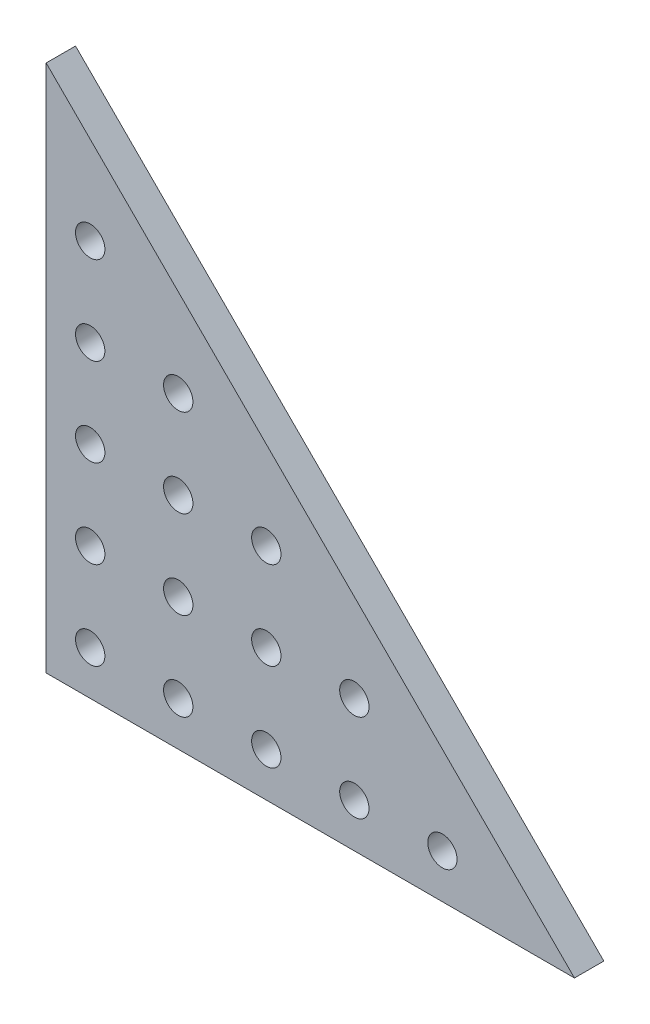
from build123d import *

# Parameters (mm, degrees)
MODEL_R                 = 1.5
SALIENTE_EXTRUIR1_DEPTH = 3


with BuildPart() as part:
    # Model → Saliente-Extruir1 (new body)
    with BuildSketch(Plane.XY):
        Polygon((-105.943383637, 105.556539338), (-105.943383637, 51.556539338), (-51.943383637, 51.556539338), align=None)
        with Locations((-101.443383637, 92.056539338)):
            Circle(MODEL_R, mode=Mode.SUBTRACT)
        with Locations((-101.443383637, 83.056539338)):
            Circle(MODEL_R, mode=Mode.SUBTRACT)
        with Locations((-92.443383637, 83.056539338)):
            Circle(MODEL_R, mode=Mode.SUBTRACT)
        with Locations((-101.443383637, 74.056539338)):
            Circle(MODEL_R, mode=Mode.SUBTRACT)
        with Locations((-92.443383637, 74.056539338)):
            Circle(MODEL_R, mode=Mode.SUBTRACT)
        with Locations((-83.443383637, 74.056539338)):
            Circle(MODEL_R, mode=Mode.SUBTRACT)
        with Locations((-101.443383637, 65.056539338)):
            Circle(MODEL_R, mode=Mode.SUBTRACT)
        with Locations((-92.443383637, 65.056539338)):
            Circle(MODEL_R, mode=Mode.SUBTRACT)
        with Locations((-83.443383637, 65.056539338)):
            Circle(MODEL_R, mode=Mode.SUBTRACT)
        with Locations((-74.443383637, 65.056539338)):
            Circle(MODEL_R, mode=Mode.SUBTRACT)
        with Locations((-101.443383637, 56.056539338)):
            Circle(MODEL_R, mode=Mode.SUBTRACT)
        with Locations((-92.443383637, 56.056539338)):
            Circle(MODEL_R, mode=Mode.SUBTRACT)
        with Locations((-83.443383637, 56.056539338)):
            Circle(MODEL_R, mode=Mode.SUBTRACT)
        with Locations((-74.443383637, 56.056539338)):
            Circle(MODEL_R, mode=Mode.SUBTRACT)
        with Locations((-65.443383637, 56.056539338)):
            Circle(MODEL_R, mode=Mode.SUBTRACT)
    extrude(amount=SALIENTE_EXTRUIR1_DEPTH)


solid = part.part
